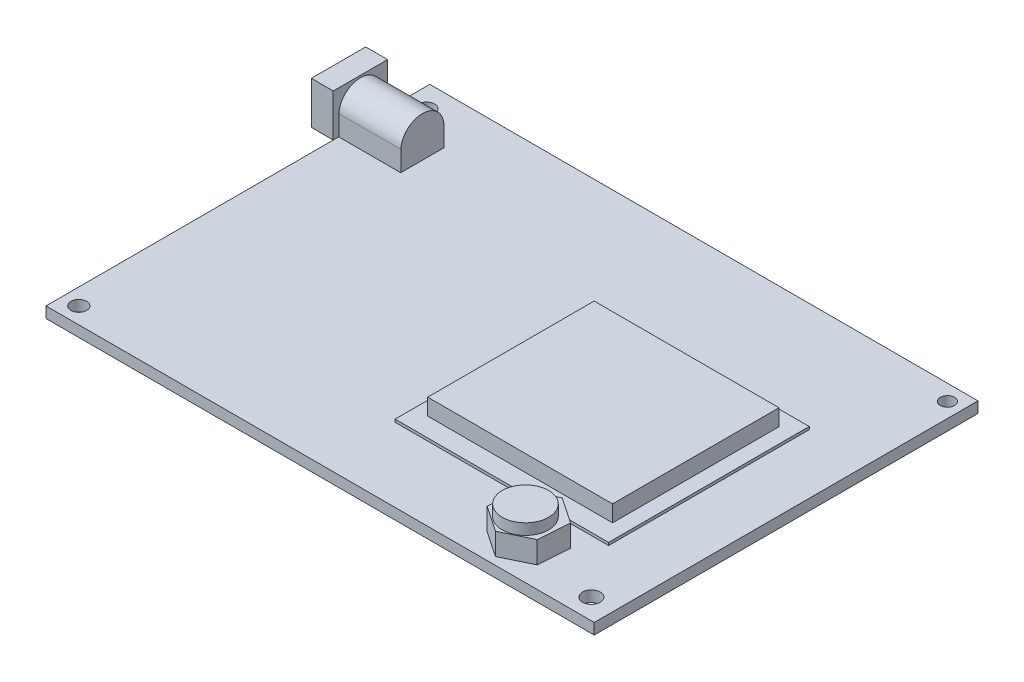
from build123d import *

# Parameters (mm, degrees)
SKETCH1_W            = 100
SKETCH1_H            = 70
BOSS_EXTRUDE2_DEPTH  = 2
SKETCH2_R            = 1.51253395
CUT_EXTRUDE3_DEPTH   = 3
SKETCH3_R            = 1.435290784
CUT_EXTRUDE4_DEPTH   = 3
SKETCH4_R            = 1.301317422
CUT_EXTRUDE5_DEPTH   = 3
SKETCH5_R            = 1.616299526
CUT_EXTRUDE6_DEPTH   = 3
SKETCH6_W            = 17.296093804
SKETCH6_H            = 7.856677749
BOSS_EXTRUDE3_DEPTH  = 7.5
CUT_EXTRUDE14_DEPTH  = 19
CUT_EXTRUDE15_DEPTH  = 19
SKETCH15_W           = 9.915871842
SKETCH15_H           = 7.754440815
BOSS_EXTRUDE6_DEPTH  = 4
SKETCH16_R           = 2.634959219
CUT_EXTRUDE16_DEPTH  = 7
SKETCH17_R           = 0.632651109
BOSS_EXTRUDE7_DEPTH  = 7
SKETCH18_W           = 38.944699871
SKETCH18_H           = 36.600864012
BOSS_EXTRUDE8_DEPTH  = 0.5
SKETCH19_W           = 33.712674361
SKETCH19_H           = 30.360976244
BOSS_EXTRUDE9_DEPTH  = 3
SKETCH20_R           = 4.233704758
BOSS_EXTRUDE10_DEPTH = 6
BOSS_EXTRUDE11_DEPTH = 4


with BuildPart() as part:
    # Sketch1 → Boss-Extrude2 (new body)
    with BuildSketch(Plane(origin=(0, 0, 0), x_dir=(1, 0, 0), z_dir=(0, 1, 0))):
        Rectangle(SKETCH1_W, SKETCH1_H)
    extrude(amount=BOSS_EXTRUDE2_DEPTH)

    # Sketch2 → Cut-Extrude3 (cut)
    with BuildSketch(Plane(origin=(0, 2, 0), x_dir=(1, 0, 0), z_dir=(0, 1, 0))):
        with Locations(Location((-46.439620532, 30.814260712, 0), (0, 0, 270))):
            Circle(SKETCH2_R)
    extrude(amount=-CUT_EXTRUDE3_DEPTH, mode=Mode.SUBTRACT)

    # Sketch3 → Cut-Extrude4 (cut)
    with BuildSketch(Plane(origin=(0, 2, 0), x_dir=(1, 0, 0), z_dir=(0, 1, 0))):
        with Locations(Location((-47.004076073, -32.008947101, 0), (0, 0, 270))):
            Circle(SKETCH3_R)
    extrude(amount=-CUT_EXTRUDE4_DEPTH, mode=Mode.SUBTRACT)

    # Sketch4 → Cut-Extrude5 (cut)
    with BuildSketch(Plane(origin=(0, 2, 0), x_dir=(1, 0, 0), z_dir=(0, 1, 0))):
        with Locations(Location((47.302855544, 32.117059369, 0), (0, 0, 270))):
            Circle(SKETCH4_R)
    extrude(amount=-CUT_EXTRUDE5_DEPTH, mode=Mode.SUBTRACT)

    # Sketch5 → Cut-Extrude6 (cut)
    with BuildSketch(Plane(origin=(0, 2, 0), x_dir=(1, 0, 0), z_dir=(0, 1, 0))):
        with Locations(Location((45.747085663, -31.267682523, 0), (0, 0, 270))):
            Circle(SKETCH5_R)
    extrude(amount=-CUT_EXTRUDE6_DEPTH, mode=Mode.SUBTRACT)

    # Sketch6 → Boss-Extrude3 (add)
    with BuildSketch(Plane(origin=(0, 2, 0), x_dir=(1, 0, 0), z_dir=(0, 1, 0))):
        with Locations((-47.333268099, 22.322741547)):
            Rectangle(SKETCH6_W, SKETCH6_H)
    extrude(amount=BOSS_EXTRUDE3_DEPTH)

    # Sketch13 → Cut-Extrude14 (cut)
    with BuildSketch(Plane.ZY.offset(55.981315001)):
        with BuildLine():
            Line((-18.394402672, 9.5), (-26.251080421, 9.5))
            Line((-26.251080421, 9.5), (-26.251080421, 5.951221756))
            ThreePointArc((-26.251080421, 5.951221756), (-22.211334605, 9.370260294), (-18.394402672, 5.704144993))
            Line((-18.394402672, 5.704144993), (-18.394402672, 9.5))
        make_face()
    extrude(amount=-CUT_EXTRUDE14_DEPTH, mode=Mode.SUBTRACT)

    # Sketch14 → Cut-Extrude15 (cut)
    with BuildSketch(Plane(origin=(0, 2, 0), x_dir=(-1, 0, 0), z_dir=(0, -1, 0))):
        Polygon((49.983450697, 17.629135674), (49.983450697, 26.82990783), (57.169456537, 26.82990783), (57.911353863, 13.473102082), align=None)
    extrude(amount=-CUT_EXTRUDE15_DEPTH, mode=Mode.SUBTRACT)

    # Sketch15 → Boss-Extrude6 (add)
    with BuildSketch(Plane.ZY.offset(49.983450697)):
        with Locations((-22.336364996, 5.892577674)):
            Rectangle(SKETCH15_W, SKETCH15_H)
    extrude(amount=BOSS_EXTRUDE6_DEPTH)

    # Sketch16 → Cut-Extrude16 (cut)
    with BuildSketch(Plane.ZY.offset(53.983450697)):
        with Locations((-22.358887933, 5.764755063)):
            Circle(SKETCH16_R)
    extrude(amount=-CUT_EXTRUDE16_DEPTH, mode=Mode.SUBTRACT)

    # Sketch17 → Boss-Extrude7 (add)
    with BuildSketch(Plane.ZY.offset(46.983450697)):
        with Locations((-22.320088974, 5.946166612)):
            Circle(SKETCH17_R)
    extrude(amount=BOSS_EXTRUDE7_DEPTH)

    # Sketch18 → Boss-Extrude8 (add)
    with BuildSketch(Plane(origin=(0, 2, 0), x_dir=(1, 0, 0), z_dir=(0, 1, 0))):
        with Locations((19.693389893, -3.245226769)):
            Rectangle(SKETCH18_W, SKETCH18_H)
    extrude(amount=BOSS_EXTRUDE8_DEPTH)

    # Sketch19 → Boss-Extrude9 (add)
    with BuildSketch(Plane(origin=(0, 2.5, 0), x_dir=(1, 0, 0), z_dir=(0, 1, 0))):
        with Locations((19.582517613, -2.921097191)):
            Rectangle(SKETCH19_W, SKETCH19_H)
    extrude(amount=BOSS_EXTRUDE9_DEPTH)

    # Sketch20 → Boss-Extrude10 (add)
    with BuildSketch(Plane(origin=(0, 2, 0), x_dir=(1, 0, 0), z_dir=(0, 1, 0))):
        with Locations(Location((30.998863529, -28.543635421, 0), (0, 0, 270))):
            Circle(SKETCH20_R)
    extrude(amount=BOSS_EXTRUDE10_DEPTH)

    # Sketch21 → Boss-Extrude11 (add)
    with BuildSketch(Plane(origin=(0, 2, 0), x_dir=(1, 0, 0), z_dir=(0, 1, 0))):
        Polygon((35.70636757, -31.11116693), (36.11182012, -25.437321781), (31.400852359, -22.249266998), (26.284432048, -24.735057364), (25.878979498, -30.408902513), (30.589947259, -33.596957296), align=None)
    extrude(amount=BOSS_EXTRUDE11_DEPTH)


solid = part.part
